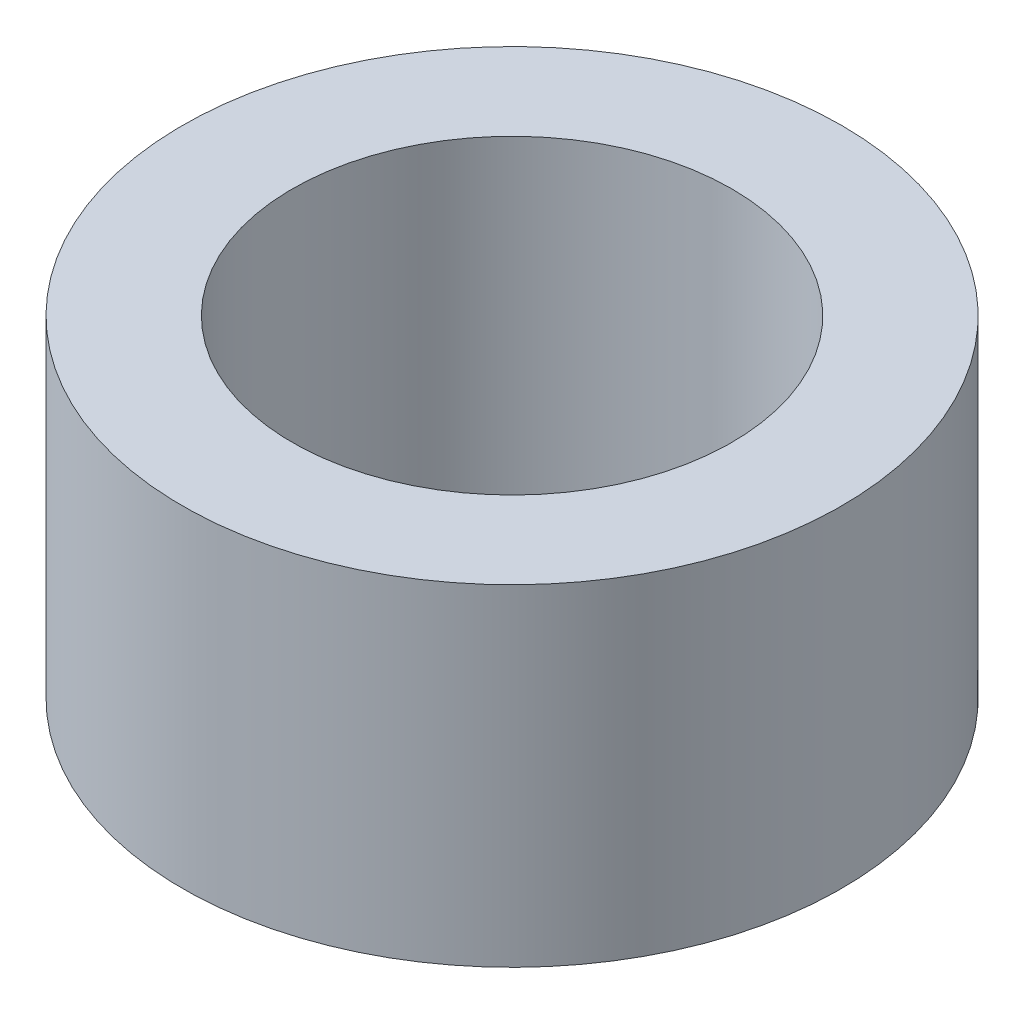
from build123d import *

# Parameters (mm, degrees)
SKETCH1_R           = 6
SKETCH1_R_2         = 4
BOSS_EXTRUDE1_DEPTH = 6.0325


with BuildPart() as part:
    # Sketch1 → Boss-Extrude1 (new body)
    with BuildSketch(Plane(origin=(0, 0, 0), x_dir=(1, 0, 0), z_dir=(0, 1, 0))):
        with Locations(Location((0, 0, 0), (0, 0, 90))):
            Circle(SKETCH1_R)
        with Locations(Location((0, 0, 0), (0, 0, 90))):
            Circle(SKETCH1_R_2, mode=Mode.SUBTRACT)
    extrude(amount=BOSS_EXTRUDE1_DEPTH)


solid = part.part
